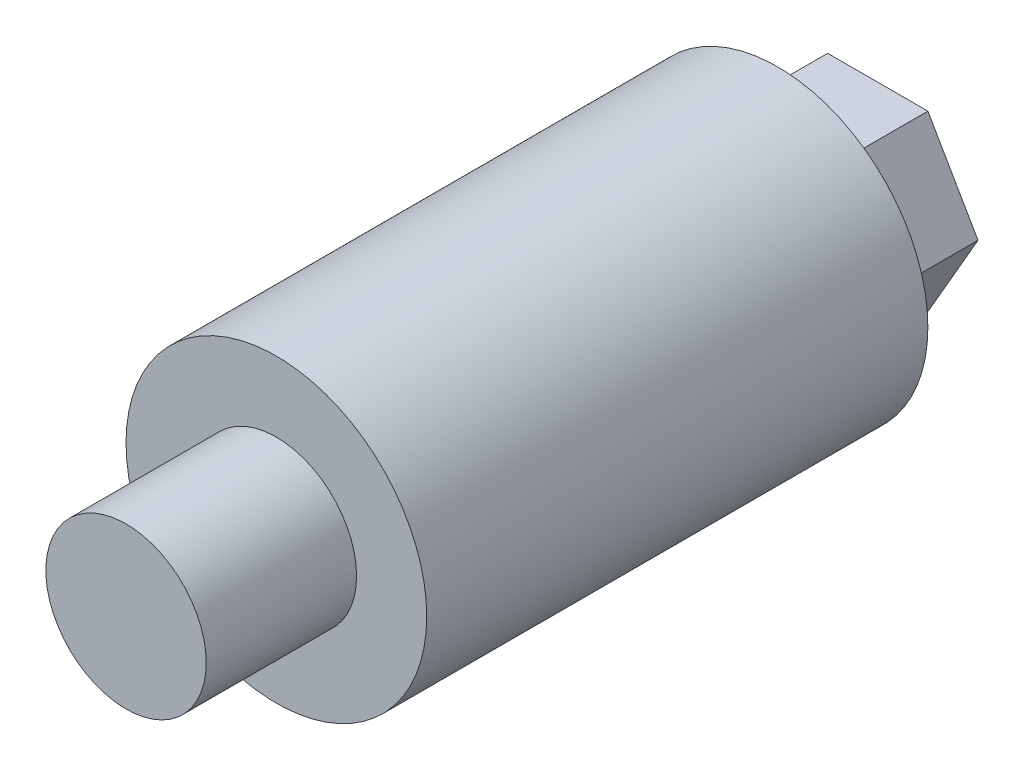
from build123d import *

# Parameters (mm, degrees)
SCHIZZO1_R                   = 15
ESTRUSIONE_ESTRUSIONE1_DEPTH = 50
SCHIZZO2_R                   = 8
ESTRUSIONE_ESTRUSIONE2_DEPTH = 15
ESTRUSIONE_ESTRUSIONE3_DEPTH = 10


with BuildPart() as part:
    # Schizzo1 → Estrusione-Estrusione1 (new body)
    with BuildSketch(Plane.XY):
        Circle(SCHIZZO1_R)
    extrude(amount=ESTRUSIONE_ESTRUSIONE1_DEPTH)

    # Schizzo2 → Estrusione-Estrusione2 (add)
    with BuildSketch(Plane.XY.offset(50)):
        Circle(SCHIZZO2_R)
    extrude(amount=ESTRUSIONE_ESTRUSIONE2_DEPTH)

    # Schizzo3 → Estrusione-Estrusione3 (add)
    with BuildSketch(Plane(origin=(0, 0, 0), x_dir=(-1, 0, 0), z_dir=(0, 0, -1))):
        Polygon((10, 0), (5, 8.660254038), (-5, 8.660254038), (-10, 0), (-5, -8.660254038), (5, -8.660254038), align=None)
    extrude(amount=ESTRUSIONE_ESTRUSIONE3_DEPTH)


solid = part.part
